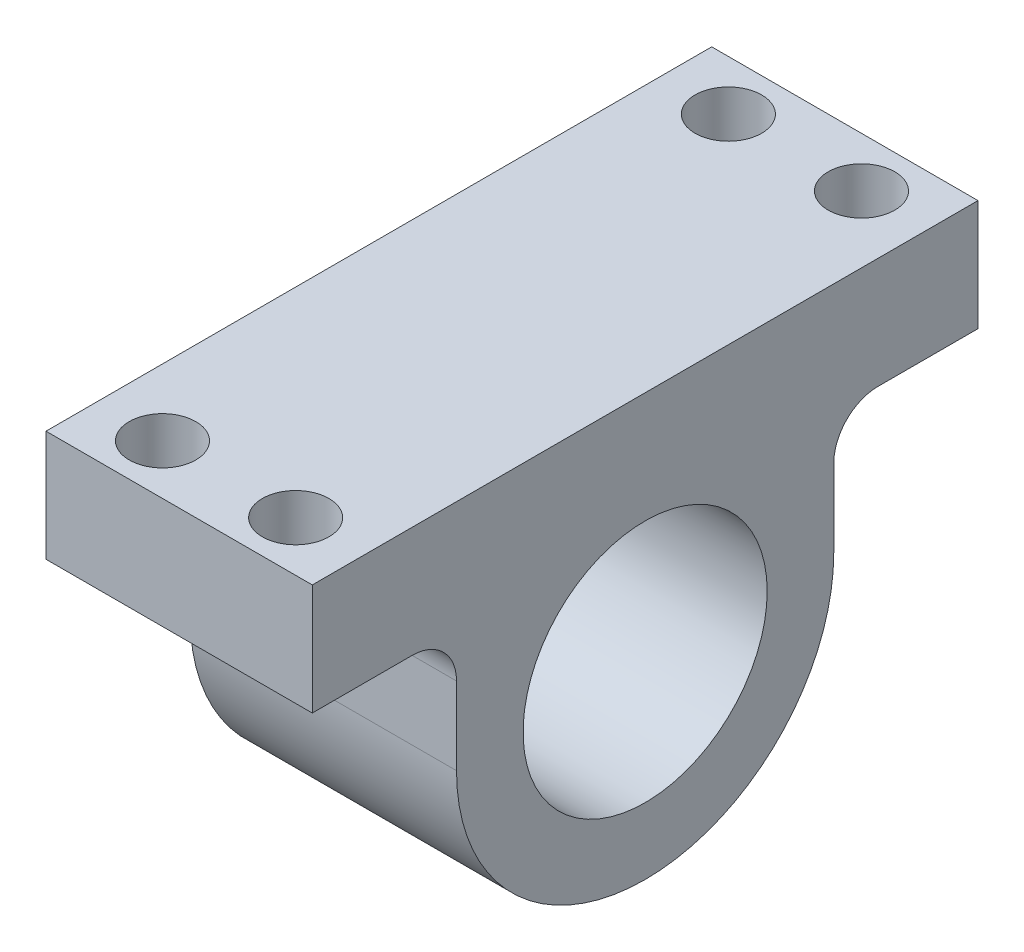
from build123d import *

# Parameters (mm, degrees)
SKETCH_2_R          = 5.5
EXTRUDE_1_DEPTH     = 12
SKETCH_5_R          = 1.5
CUT_EXTRUDE_1_DEPTH = 5


with BuildPart() as part:
    # 草图2 → 凸台-拉伸1 (new body)
    with BuildSketch(Plane(origin=(0, 0, 0), x_dir=(0, 0, -1), z_dir=(1, 0, 0))):
        with BuildLine():
            Line((-15, 5.5), (-15, 10.5))
            Line((-15, 10.5), (15, 10.5))
            Line((15, 10.5), (15, 5.5))
            Line((15, 5.5), (10.5, 5.5))
            ThreePointArc((10.5, 5.5), (9.085786438, 4.914213562), (8.5, 3.5))
            Line((8.5, 3.5), (8.5, 0))
            ThreePointArc((8.5, 0), (0, -8.5), (-8.5, 0))
            Line((-8.5, 0), (-8.5, 3.5))
            ThreePointArc((-8.5, 3.5), (-9.085786438, 4.914213562), (-10.5, 5.5))
            Line((-10.5, 5.5), (-15, 5.5))
        make_face()
        Circle(SKETCH_2_R, mode=Mode.SUBTRACT)
    extrude(amount=EXTRUDE_1_DEPTH)

    # 草图5 → 切除-拉伸1 (cut)
    with BuildSketch(Plane.XZ.offset(-5.5)):
        with Locations(Location((3, 12.75, 0), (0, 0, 270))):
            Circle(SKETCH_5_R)
        with Locations(Location((9, 12.75, 0), (0, 0, 270))):
            Circle(SKETCH_5_R)
        with Locations(Location((9, -12.75, 0), (0, 0, 270))):
            Circle(SKETCH_5_R)
        with Locations(Location((3, -12.75, 0), (0, 0, 270))):
            Circle(SKETCH_5_R)
    extrude(amount=-CUT_EXTRUDE_1_DEPTH, mode=Mode.SUBTRACT)


solid = part.part
